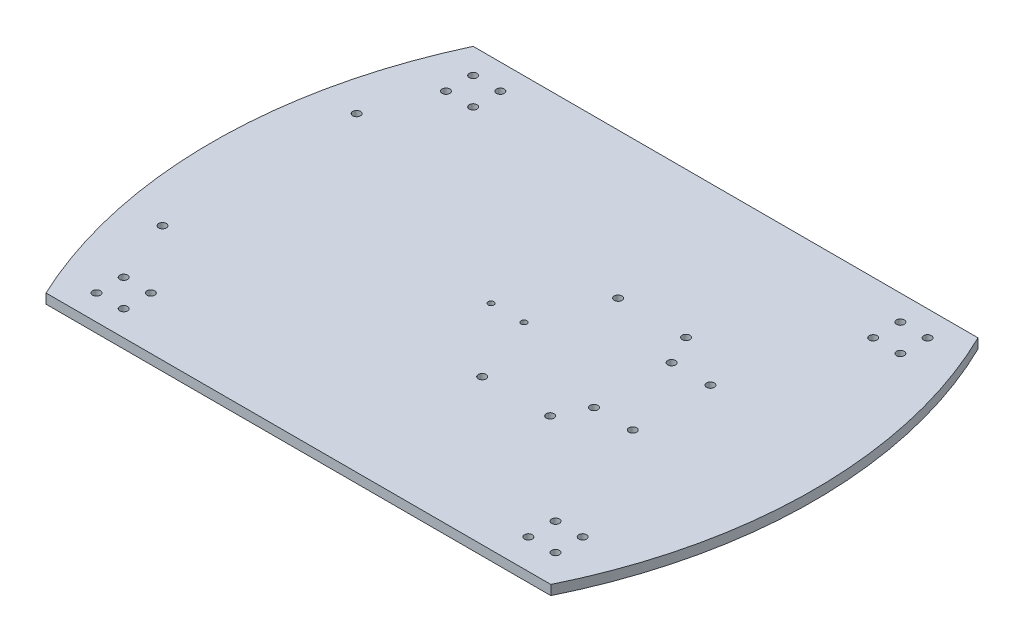
from build123d import *

# Parameters (mm, degrees)
SKETCH_1_R      = 2
SKETCH_1_R_2    = 1.5
EXTRUDE_2_DEPTH = 5


with BuildPart() as part:
    # 草图1 → 凸台-拉伸2 (new body)
    with BuildSketch(Plane(origin=(0, 0, 0), x_dir=(1, 0, 0), z_dir=(0, 1, 0))):
        with BuildLine():
            Line((-131.385271199, 145), (128.614728801, 145))
            ThreePointArc((128.614728801, 145), (154.115285595, 35), (128.614728801, -75))
            Line((128.614728801, -75), (-131.385271199, -75))
            ThreePointArc((-131.385271199, -75), (-155.884714405, 35), (-131.385271199, 145))
        make_face()
        with Locations(Location((-104.385271199, 118, 0), (0, 0, 270))):
            Circle(SKETCH_1_R, mode=Mode.SUBTRACT)
        with Locations(Location((-118.385271199, 132, 0), (0, 0, 270))):
            Circle(SKETCH_1_R, mode=Mode.SUBTRACT)
        with Locations(Location((-118.385271199, 118, 0), (0, 0, 270))):
            Circle(SKETCH_1_R, mode=Mode.SUBTRACT)
        with Locations(Location((-104.385271199, 132, 0), (0, 0, 270))):
            Circle(SKETCH_1_R, mode=Mode.SUBTRACT)
        with Locations(Location((101.614728801, 132, 0), (0, 0, 270))):
            Circle(SKETCH_1_R, mode=Mode.SUBTRACT)
        with Locations(Location((101.614728801, 118, 0), (0, 0, 270))):
            Circle(SKETCH_1_R, mode=Mode.SUBTRACT)
        with Locations(Location((115.614728801, 118, 0), (0, 0, 270))):
            Circle(SKETCH_1_R, mode=Mode.SUBTRACT)
        with Locations(Location((115.614728801, 132, 0), (0, 0, 270))):
            Circle(SKETCH_1_R, mode=Mode.SUBTRACT)
        with Locations(Location((115.614728801, -45.585551803, 0), (0, 0, 270))):
            Circle(SKETCH_1_R, mode=Mode.SUBTRACT)
        with Locations(Location((115.614728801, -59.585551803, 0), (0, 0, 270))):
            Circle(SKETCH_1_R, mode=Mode.SUBTRACT)
        with Locations(Location((101.614728801, -59.585551803, 0), (0, 0, 270))):
            Circle(SKETCH_1_R, mode=Mode.SUBTRACT)
        with Locations(Location((101.614728801, -45.585551803, 0), (0, 0, 270))):
            Circle(SKETCH_1_R, mode=Mode.SUBTRACT)
        with Locations(Location((-118.385271199, -48, 0), (0, 0, 270))):
            Circle(SKETCH_1_R, mode=Mode.SUBTRACT)
        with Locations(Location((-118.385271199, -62, 0), (0, 0, 270))):
            Circle(SKETCH_1_R, mode=Mode.SUBTRACT)
        with Locations(Location((-104.385271199, -48, 0), (0, 0, 270))):
            Circle(SKETCH_1_R, mode=Mode.SUBTRACT)
        with Locations(Location((-104.385271199, -62, 0), (0, 0, 270))):
            Circle(SKETCH_1_R, mode=Mode.SUBTRACT)
        with Locations(Location((-12.193281543, 35, 0), (0, 0, 270))):
            Circle(SKETCH_1_R_2, mode=Mode.SUBTRACT)
        with Locations(Location((4.806718457, 35, 0), (0, 0, 270))):
            Circle(SKETCH_1_R_2, mode=Mode.SUBTRACT)
        with Locations(Location((-131.385271199, 85, 0), (0, 0, 270))):
            Circle(SKETCH_1_R, mode=Mode.SUBTRACT)
        with Locations(Location((-131.385271199, -15, 0), (0, 0, 270))):
            Circle(SKETCH_1_R, mode=Mode.SUBTRACT)
        with Locations(Location((18.256265761, 70, 0), (0, 0, 270))):
            Circle(SKETCH_1_R, mode=Mode.SUBTRACT)
        with Locations(Location((53.256265761, 70, 0), (0, 0, 270))):
            Circle(SKETCH_1_R, mode=Mode.SUBTRACT)
        with Locations(Location((53.256265761, 0, 0), (0, 0, 270))):
            Circle(SKETCH_1_R, mode=Mode.SUBTRACT)
        with Locations(Location((18.256265761, 0, 0), (0, 0, 270))):
            Circle(SKETCH_1_R, mode=Mode.SUBTRACT)
        with Locations(Location((60.81589639, 55, 0), (0, 0, 270))):
            Circle(SKETCH_1_R, mode=Mode.SUBTRACT)
        with Locations(Location((80.81589639, 55, 0), (0, 0, 270))):
            Circle(SKETCH_1_R, mode=Mode.SUBTRACT)
        with Locations(Location((80.81589639, 15, 0), (0, 0, 270))):
            Circle(SKETCH_1_R, mode=Mode.SUBTRACT)
        with Locations(Location((60.81589639, 15, 0), (0, 0, 270))):
            Circle(SKETCH_1_R, mode=Mode.SUBTRACT)
    extrude(amount=EXTRUDE_2_DEPTH)


solid = part.part
